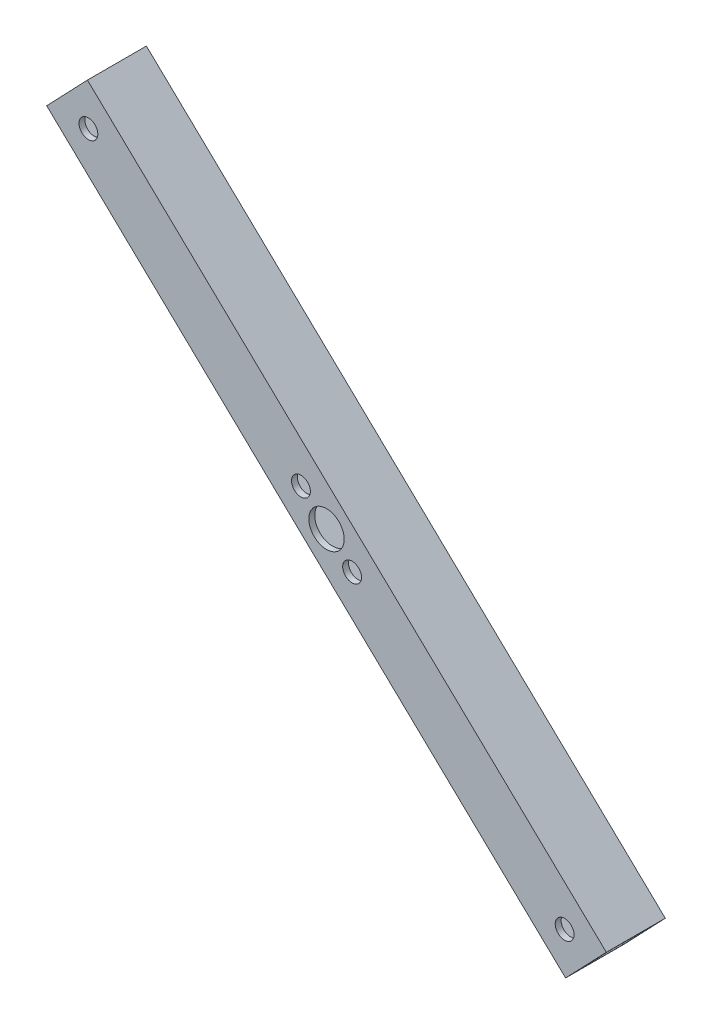
from build123d import *

# Parameters (mm, degrees)
SKETCH_2_R          = 1.6
EXTRUDE_1_DEPTH     = 10
SKETCH_3_W          = 8
SKETCH_3_H          = 8
CUT_EXTRUDE_1_DEPTH = 140.947387002
SKETCH_4_R          = 1.6
SKETCH_4_R_2        = 3
CUT_EXTRUDE_2_DEPTH = 10


with BuildPart() as part:
    # ｽｹｯﾁ2 → ﾎﾞｽ - 押し出し1 (new body)
    with BuildSketch(Plane.XY):
        Polygon((83.071643169, 8.195972832), (-3.936021884, 91.354077293), (-10.845357286, 84.124894469), (77.150331852, 0.022479987), (84.059667254, 7.25166281), align=None)
        with Locations((-3.776098173, 84.28481818)):
            Circle(SKETCH_2_R, mode=Mode.SUBTRACT)
        with Locations((76.990408141, 7.0917391)):
            Circle(SKETCH_2_R, mode=Mode.SUBTRACT)
    extrude(amount=EXTRUDE_1_DEPTH)

    # ｽｹｯﾁ3 → ｶｯﾄ - 押し出し1 (cut, through all)
    with BuildSketch(Plane(origin=(40.308371471, -38.524970914, 0), x_dir=(0, 0, -1), z_dir=(0.7229182823698357, -0.690933540230496, 0))):
        with Locations((-5, 58.32200311)):
            Rectangle(SKETCH_3_W, SKETCH_3_H)
    extrude(amount=-CUT_EXTRUDE_1_DEPTH, mode=Mode.SUBTRACT)

    # ｽｹｯﾁ4 → ｶｯﾄ - 押し出し2 (cut)
    with BuildSketch(Plane.XY.offset(10)):
        with Locations((40.944664678, 41.542677398)):
            Circle(SKETCH_4_R)
        with Locations((32.26964529, 49.833879881)):
            Circle(SKETCH_4_R)
        with Locations((36.607154984, 45.68827864)):
            Circle(SKETCH_4_R_2)
    extrude(amount=-CUT_EXTRUDE_2_DEPTH, mode=Mode.SUBTRACT)


solid = part.part
